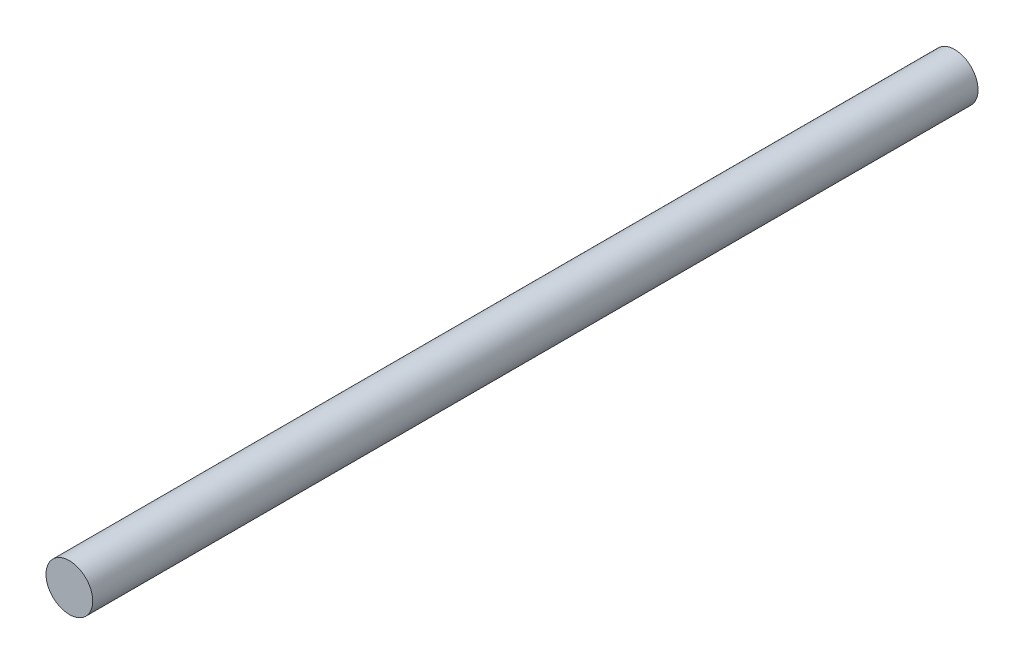
from build123d import *

# Parameters (mm, degrees)
SKETCH1_R           = 3
BOSS_EXTRUDE1_DEPTH = 113.7


with BuildPart() as part:
    # Sketch1 → Boss-Extrude1 (new body)
    with BuildSketch(Plane.XY):
        with Locations(Location((0, 0, 0), (0, 0, 180))):
            Circle(SKETCH1_R)
    extrude(amount=BOSS_EXTRUDE1_DEPTH)


solid = part.part
